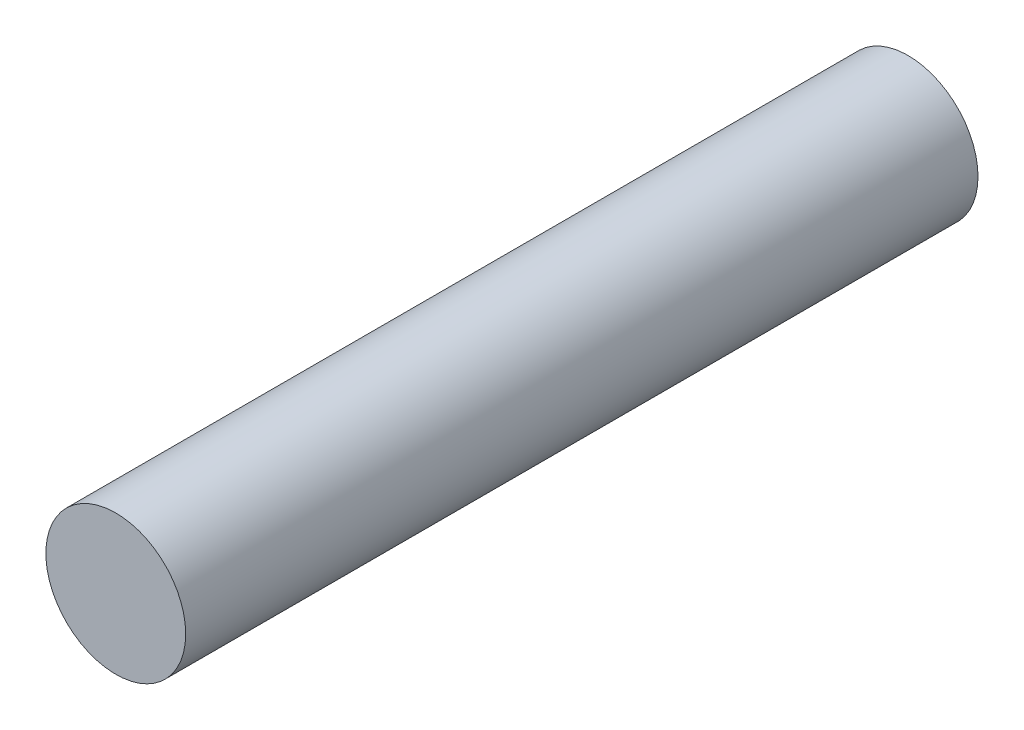
from build123d import *

# Parameters (mm, degrees)
ESQUISSE1_R        = 3
BOSS_EXTRU_1_DEPTH = 34.000000056


with BuildPart() as part:
    # Esquisse1 → Boss.-Extru.1 (new body)
    with BuildSketch(Plane.XY):
        Circle(ESQUISSE1_R)
    extrude(amount=BOSS_EXTRU_1_DEPTH)


solid = part.part
